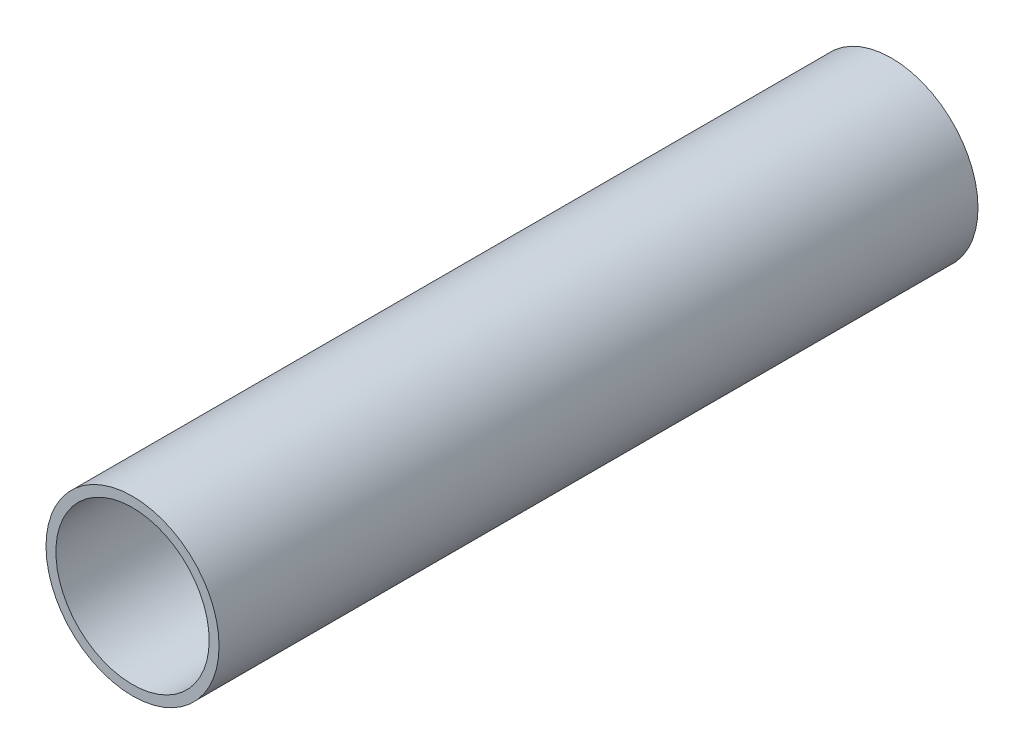
from build123d import *

# Parameters (mm, degrees)
ESQUISSE1_R        = 57
ESQUISSE1_R_2      = 50.5
BOSS_EXTRU_1_DEPTH = 500


with BuildPart() as part:
    # Esquisse1 → Boss.-Extru.1 (new body)
    with BuildSketch(Plane.XY):
        Circle(ESQUISSE1_R)
        Circle(ESQUISSE1_R_2, mode=Mode.SUBTRACT)
    extrude(amount=BOSS_EXTRU_1_DEPTH)


solid = part.part
